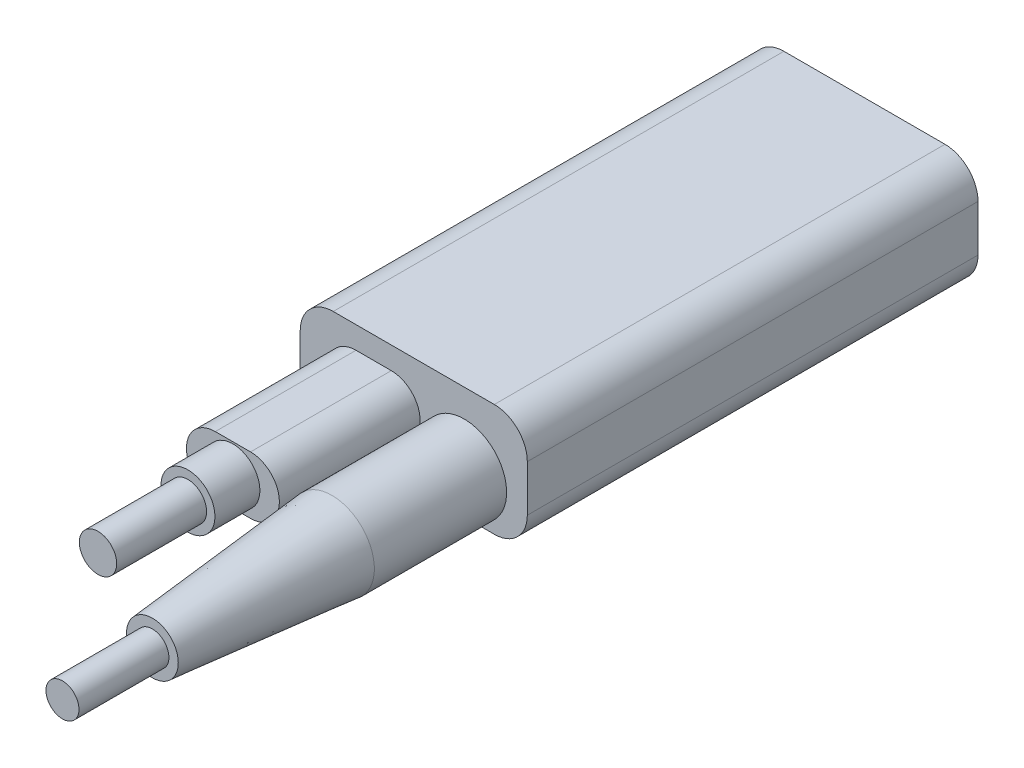
from build123d import *

# Parameters (mm, degrees)
SKETCH1_W           = 25.25
SKETCH1_H           = 12.5
BOSS_EXTRUDE1_DEPTH = 25.055
SKETCH2_W           = 14.5
SKETCH2_H           = 5.7
CUT_EXTRUDE1_DEPTH  = 10
BOSS_EXTRUDE2_DEPTH = 15.65
SKETCH4_R           = 4.715
BOSS_EXTRUDE3_DEPTH = 14.71
SKETCH5_R           = 2.875
SKETCH6_R           = 1.835
BOSS_EXTRUDE4_DEPTH = 10
SKETCH7_R           = 3
BOSS_EXTRUDE5_DEPTH = 5
SKETCH8_R           = 2.075
BOSS_EXTRUDE6_DEPTH = 10
FILLET1_R           = 3.67


with BuildPart() as part:
    # Sketch1 → Boss-Extrude1 (new, symmetric)
    with BuildSketch(Plane.XY):
        Rectangle(SKETCH1_W, SKETCH1_H)
    extrude(amount=BOSS_EXTRUDE1_DEPTH, both=True)

    # Sketch2 → Cut-Extrude1 (cut)
    with BuildSketch(Plane(origin=(0, 0, -25.055), x_dir=(-1, 0, 0), z_dir=(0, 0, -1))):
        with Locations((0, -1.17)):
            Rectangle(SKETCH2_W, SKETCH2_H)
    extrude(amount=-CUT_EXTRUDE1_DEPTH, mode=Mode.SUBTRACT)

    # Sketch3 → Boss-Extrude2 (add)
    with BuildSketch(Plane.XY.offset(25.055)):
        with BuildLine():
            Line((-6.42, 3.78), (-2.5, 3.78))
            ThreePointArc((-2.5, 3.78), (0.705, 0.575), (-2.5, -2.63))
            Line((-2.5, -2.63), (-6.42, -2.63))
            ThreePointArc((-6.42, -2.63), (-9.625, 0.575), (-6.42, 3.78))
        make_face()
    extrude(amount=BOSS_EXTRUDE2_DEPTH)

    # Sketch4 → Boss-Extrude3 (add)
    with BuildSketch(Plane.XY.offset(25.055)):
        with Locations(Location((5.61, -1.535, 0), (0, 0, 270))):
            Circle(SKETCH4_R)
    extrude(amount=BOSS_EXTRUDE3_DEPTH)

    # Sketch5 → section 1 of loft1
    with BuildSketch(Plane.XY.offset(59.725), mode=Mode.PRIVATE) as loft1_s1:
        with Locations((5.61, -1.535)):
            Circle(SKETCH5_R)
    # loft from a face of the part (loft1)
    loft([part.faces().sort_by_distance((5.61, -1.535, 39.765))[0], loft1_s1.sketch])

    # Sketch6 → Boss-Extrude4 (add)
    with BuildSketch(Plane.XY.offset(59.725)):
        with Locations((5.61, -1.535)):
            Circle(SKETCH6_R)
    extrude(amount=BOSS_EXTRUDE4_DEPTH)

    # Sketch7 → Boss-Extrude5 (add)
    with BuildSketch(Plane.XY.offset(40.705)):
        with Locations((-4.46, 0.575)):
            Circle(SKETCH7_R)
    extrude(amount=BOSS_EXTRUDE5_DEPTH)

    # Sketch8 → Boss-Extrude6 (add)
    with BuildSketch(Plane.XY.offset(45.705)):
        with Locations((-4.46, 0.575)):
            Circle(SKETCH8_R)
    extrude(amount=BOSS_EXTRUDE6_DEPTH)

    # Fillet1
    fillet1_edges = [part.edges().sort_by_distance(p)[0] for p in [
        (12.625, -6.25, 0),
        (-12.625, -6.25, 0),
        (-12.625, 6.25, 0),
        (12.625, 6.25, 0),
    ]]
    fillet(fillet1_edges, radius=FILLET1_R)


solid = part.part
